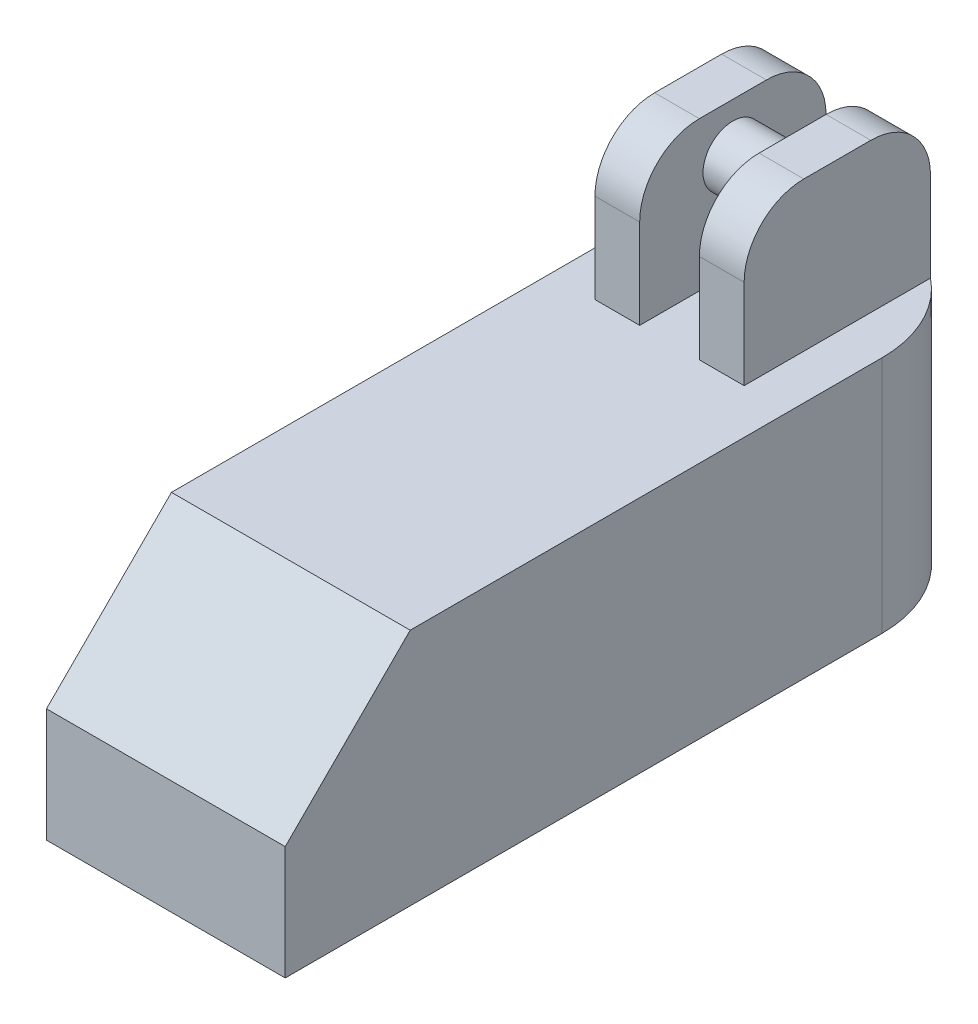
from build123d import *

# Parameters (mm, degrees)
SKETCH1_R           = 50.8
BOSS_EXTRUDE1_DEPTH = 203.2
SKETCH2_W           = 63.5
SKETCH2_H           = 79.31147458
BOSS_EXTRUDE2_DEPTH = 63.5
SKETCH3_W           = 25.4
SKETCH3_H           = 79.31147458
CUT_EXTRUDE1_DEPTH  = 63.5
FILLET1_R           = 25.4
SKETCH4_R           = 31.75
CUT_EXTRUDE2_DEPTH  = 63.5
SKETCH6_W           = 101.6
SKETCH6_H           = 101.6
BOSS_EXTRUDE3_DEPTH = 254
SKETCH7_W           = 106.066491774
SKETCH7_H           = 101.6
CUT_EXTRUDE4_DEPTH  = 409.182030472
CHAMFER2_SIZE       = 53.18
SKETCH5_R           = 12.7
BOSS_EXTRUDE5_DEPTH = 53.34
SKETCH11_R          = 38.1
CUT_EXTRUDE7_DEPTH  = 50.8


with BuildPart() as part:
    # Sketch1 → Boss-Extrude1 (new body)
    with BuildSketch(Plane(origin=(0, 0, 0), x_dir=(1, 0, 0), z_dir=(0, 1, 0))):
        with Locations(Location((0, 0, 0), (0, 0, 270))):
            Circle(SKETCH1_R)
    extrude(amount=BOSS_EXTRUDE1_DEPTH)

    # Sketch2 → Boss-Extrude2 (add)
    with BuildSketch(Plane(origin=(0, 203.2, 0), x_dir=(1, 0, 0), z_dir=(0, 1, 0))):
        Rectangle(SKETCH2_W, SKETCH2_H)
    extrude(amount=BOSS_EXTRUDE2_DEPTH)

    # Sketch3 → Cut-Extrude1 (cut)
    with BuildSketch(Plane(origin=(0, 266.7, 0), x_dir=(1, 0, 0), z_dir=(0, 1, 0))):
        Rectangle(SKETCH3_W, SKETCH3_H)
    extrude(amount=-CUT_EXTRUDE1_DEPTH, mode=Mode.SUBTRACT)

    # Fillet1
    fillet1_edges = [part.edges().sort_by_distance(p)[0] for p in [
        (22.225, 266.7, -39.65573729),
        (-22.225, 266.7, 39.65573729),
        (-22.225, 266.7, -39.65573729),
        (22.225, 266.7, 39.65573729),
    ]]
    fillet(fillet1_edges, radius=FILLET1_R)

    # Sketch4 → Cut-Extrude2 (cut)
    with BuildSketch(Plane.XZ):
        with Locations(Location((0, 0, 0), (0, 0, 270))):
            Circle(SKETCH4_R)
    extrude(amount=-CUT_EXTRUDE2_DEPTH, mode=Mode.SUBTRACT)

    # Sketch6 → Boss-Extrude3 (add)
    with BuildSketch(Plane.XY):
        with Locations((0, 152.4)):
            Rectangle(SKETCH6_W, SKETCH6_H)
    extrude(amount=BOSS_EXTRUDE3_DEPTH)

    # Sketch7 → Cut-Extrude4 (cut, through all)
    with BuildSketch(Plane.XY.offset(254)):
        with Locations((2.233245887, 50.8)):
            Rectangle(SKETCH7_W, SKETCH7_H)
    extrude(amount=-CUT_EXTRUDE4_DEPTH, mode=Mode.SUBTRACT)

    # Chamfer2
    chamfer2_edges = [part.edges().sort_by_distance(p)[0] for p in [
        (0, 203.2, 254),
    ]]
    chamfer(chamfer2_edges, length=CHAMFER2_SIZE)

    # Sketch5 → Boss-Extrude5 (add)
    with BuildSketch(Plane(origin=(31.75, 0, 0), x_dir=(0, 0, -1), z_dir=(1, 0, 0))):
        with Locations((0, 245.993497046)):
            Circle(SKETCH5_R)
    extrude(amount=-BOSS_EXTRUDE5_DEPTH)

    # Sketch11 → Cut-Extrude7 (cut)
    with BuildSketch(Plane.XZ.offset(-101.6)):
        with Locations(Location((0, 127, 0), (0, 0, 270))):
            Circle(SKETCH11_R)
    extrude(amount=-CUT_EXTRUDE7_DEPTH, mode=Mode.SUBTRACT)


solid = part.part
